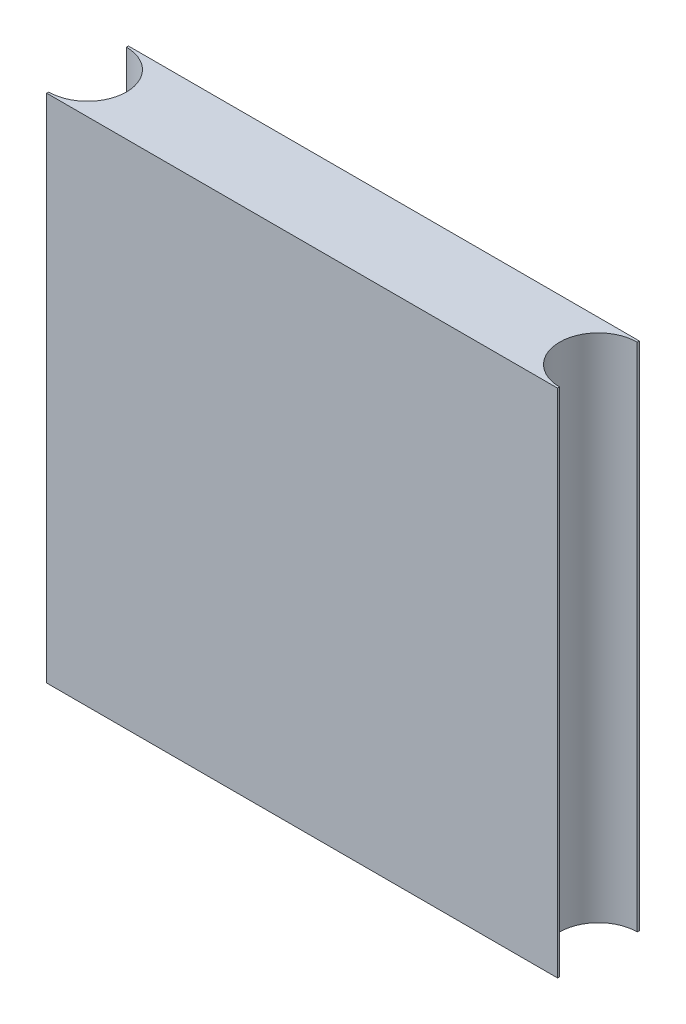
from build123d import *

# Parameters (mm, degrees)
SKETCH1_W           = 50
SKETCH1_H           = 50
BOSS_EXTRUDE3_DEPTH = 8
SKETCH6_R           = 3.8
CUT_EXTRUDE2_DEPTH  = 68


with BuildPart() as part:
    # Sketch1 → Boss-Extrude3 (new body)
    with BuildSketch(Plane.XY):
        with Locations((25, 25)):
            Rectangle(SKETCH1_W, SKETCH1_H)
    extrude(amount=BOSS_EXTRUDE3_DEPTH)

    # Sketch6 → Cut-Extrude2 (cut)
    with BuildSketch(Plane.XZ):
        with Locations((0, 4)):
            Circle(SKETCH6_R)
        with Locations((50, 4)):
            Circle(SKETCH6_R)
    extrude(amount=-CUT_EXTRUDE2_DEPTH, mode=Mode.SUBTRACT)


solid = part.part
